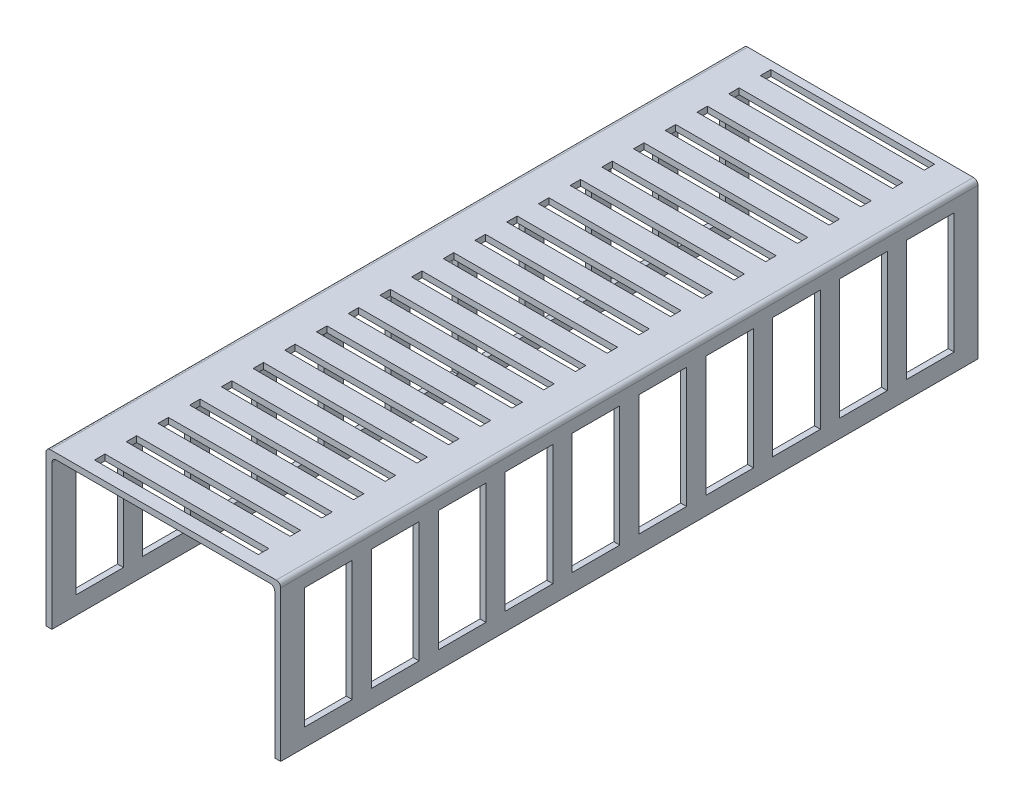
from build123d import *

# Parameters (mm, degrees)
SKETCH2_W           = 78.8
SKETCH2_H           = 234.1
SKETCH2_W_2         = 55
SKETCH2_H_2         = 3.5
BOSS_EXTRUDE1_DEPTH = 2
SKETCH3_W           = 2
SKETCH3_H           = 234.1
BOSS_EXTRUDE2_DEPTH = 50
FILLET1_R           = 1.5
SKETCH4_W           = 16
SKETCH4_H           = 40.5
CUT_EXTRUDE1_DEPTH  = 26569.804290094


with BuildPart() as part:
    # Sketch2 → Boss-Extrude1 (new body)
    with BuildSketch(Plane(origin=(0, 26566.349263039, 0), x_dir=(1, 0, 0), z_dir=(0, 1, 0))):
        with Locations((-7.2, 17)):
            Rectangle(SKETCH2_W, SKETCH2_H)
        with Locations((-7.2, 119.004761905)):
            Rectangle(SKETCH2_W_2, SKETCH2_H_2, mode=Mode.SUBTRACT)
        with Locations((-7.2, 129.65)):
            Rectangle(SKETCH2_W_2, SKETCH2_H_2, mode=Mode.SUBTRACT)
        with Locations((-7.2, 108.35952381)):
            Rectangle(SKETCH2_W_2, SKETCH2_H_2, mode=Mode.SUBTRACT)
        with Locations((-7.2, 97.714285714)):
            Rectangle(SKETCH2_W_2, SKETCH2_H_2, mode=Mode.SUBTRACT)
        with Locations((-7.2, 87.069047619)):
            Rectangle(SKETCH2_W_2, SKETCH2_H_2, mode=Mode.SUBTRACT)
        with Locations((-7.2, 76.423809524)):
            Rectangle(SKETCH2_W_2, SKETCH2_H_2, mode=Mode.SUBTRACT)
        with Locations((-7.2, 65.778571429)):
            Rectangle(SKETCH2_W_2, SKETCH2_H_2, mode=Mode.SUBTRACT)
        with Locations((-7.2, 55.133333333)):
            Rectangle(SKETCH2_W_2, SKETCH2_H_2, mode=Mode.SUBTRACT)
        with Locations((-7.2, 44.488095238)):
            Rectangle(SKETCH2_W_2, SKETCH2_H_2, mode=Mode.SUBTRACT)
        with Locations((-7.2, 33.842857143)):
            Rectangle(SKETCH2_W_2, SKETCH2_H_2, mode=Mode.SUBTRACT)
        with Locations((-7.2, 23.197619048)):
            Rectangle(SKETCH2_W_2, SKETCH2_H_2, mode=Mode.SUBTRACT)
        with Locations((-7.2, 12.552380952)):
            Rectangle(SKETCH2_W_2, SKETCH2_H_2, mode=Mode.SUBTRACT)
        with Locations((-7.2, 1.907142857)):
            Rectangle(SKETCH2_W_2, SKETCH2_H_2, mode=Mode.SUBTRACT)
        with Locations((-7.2, -8.738095238)):
            Rectangle(SKETCH2_W_2, SKETCH2_H_2, mode=Mode.SUBTRACT)
        with Locations((-7.2, -19.383333333)):
            Rectangle(SKETCH2_W_2, SKETCH2_H_2, mode=Mode.SUBTRACT)
        with Locations((-7.2, -30.028571429)):
            Rectangle(SKETCH2_W_2, SKETCH2_H_2, mode=Mode.SUBTRACT)
        with Locations((-7.2, -40.673809524)):
            Rectangle(SKETCH2_W_2, SKETCH2_H_2, mode=Mode.SUBTRACT)
        with Locations((-7.2, -51.319047619)):
            Rectangle(SKETCH2_W_2, SKETCH2_H_2, mode=Mode.SUBTRACT)
        with Locations((-7.2, -61.964285714)):
            Rectangle(SKETCH2_W_2, SKETCH2_H_2, mode=Mode.SUBTRACT)
        with Locations((-7.2, -72.60952381)):
            Rectangle(SKETCH2_W_2, SKETCH2_H_2, mode=Mode.SUBTRACT)
        with Locations((-7.2, -83.254761905)):
            Rectangle(SKETCH2_W_2, SKETCH2_H_2, mode=Mode.SUBTRACT)
        with Locations((-7.2, -93.9)):
            Rectangle(SKETCH2_W_2, SKETCH2_H_2, mode=Mode.SUBTRACT)
    extrude(amount=BOSS_EXTRUDE1_DEPTH)

    # Sketch3 → Boss-Extrude2 (add)
    with BuildSketch(Plane.XZ.offset(-26566.349263039)):
        with Locations((-45.6, -17)):
            Rectangle(SKETCH3_W, SKETCH3_H)
        with Locations((31.2, -17)):
            Rectangle(SKETCH3_W, SKETCH3_H)
    extrude(amount=BOSS_EXTRUDE2_DEPTH)

    # Fillet1
    fillet1_edges = [part.edges().sort_by_distance(p)[0] for p in [
        (32.2, 26568.349263039, -17),
        (-44.6, 26566.349263039, -17),
        (30.2, 26566.349263039, -17),
        (-46.6, 26568.349263039, -17),
    ]]
    fillet(fillet1_edges, radius=FILLET1_R)

    # Sketch4 → Cut-Extrude1 (cut, through all)
    with BuildSketch(Plane(origin=(32.2, 0, 0), x_dir=(0, 0, -1), z_dir=(1, 0, 0))):
        with Locations((-84.05, 26542.599263039)):
            Rectangle(SKETCH4_W, SKETCH4_H)
        with Locations((-61.594444444, 26542.599263039)):
            Rectangle(SKETCH4_W, SKETCH4_H)
        with Locations((-39.138888889, 26542.599263039)):
            Rectangle(SKETCH4_W, SKETCH4_H)
        with Locations((-16.683333333, 26542.599263039)):
            Rectangle(SKETCH4_W, SKETCH4_H)
        with Locations((5.772222222, 26542.599263039)):
            Rectangle(SKETCH4_W, SKETCH4_H)
        with Locations((28.227777778, 26542.599263039)):
            Rectangle(SKETCH4_W, SKETCH4_H)
        with Locations((50.683333333, 26542.599263039)):
            Rectangle(SKETCH4_W, SKETCH4_H)
        with Locations((73.138888889, 26542.599263039)):
            Rectangle(SKETCH4_W, SKETCH4_H)
        with Locations((95.594444444, 26542.599263039)):
            Rectangle(SKETCH4_W, SKETCH4_H)
        with Locations((118.05, 26542.599263039)):
            Rectangle(SKETCH4_W, SKETCH4_H)
    extrude(amount=-CUT_EXTRUDE1_DEPTH, mode=Mode.SUBTRACT)


solid = part.part
